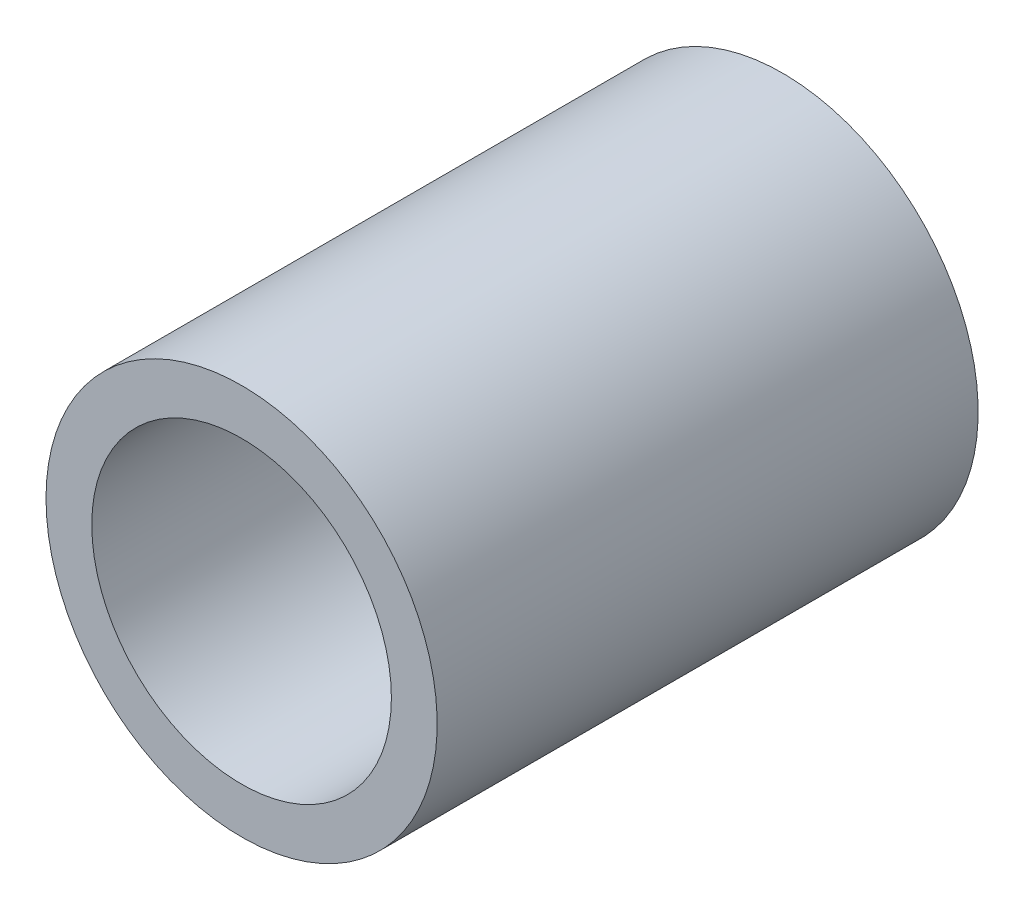
from build123d import *

# Parameters (mm, degrees)
ESQUISSE1_R        = 4.7
ESQUISSE1_R_2      = 3.6
BOSS_EXTRU_1_DEPTH = 13


with BuildPart() as part:
    # Esquisse1 → Boss.-Extru.1 (new body)
    with BuildSketch(Plane.XY):
        with Locations(Location((0, 0, 0), (0, 0, 180))):
            Circle(ESQUISSE1_R)
        with Locations(Location((0, 0, 0), (0, 0, 180))):
            Circle(ESQUISSE1_R_2, mode=Mode.SUBTRACT)
    extrude(amount=BOSS_EXTRU_1_DEPTH)


solid = part.part
